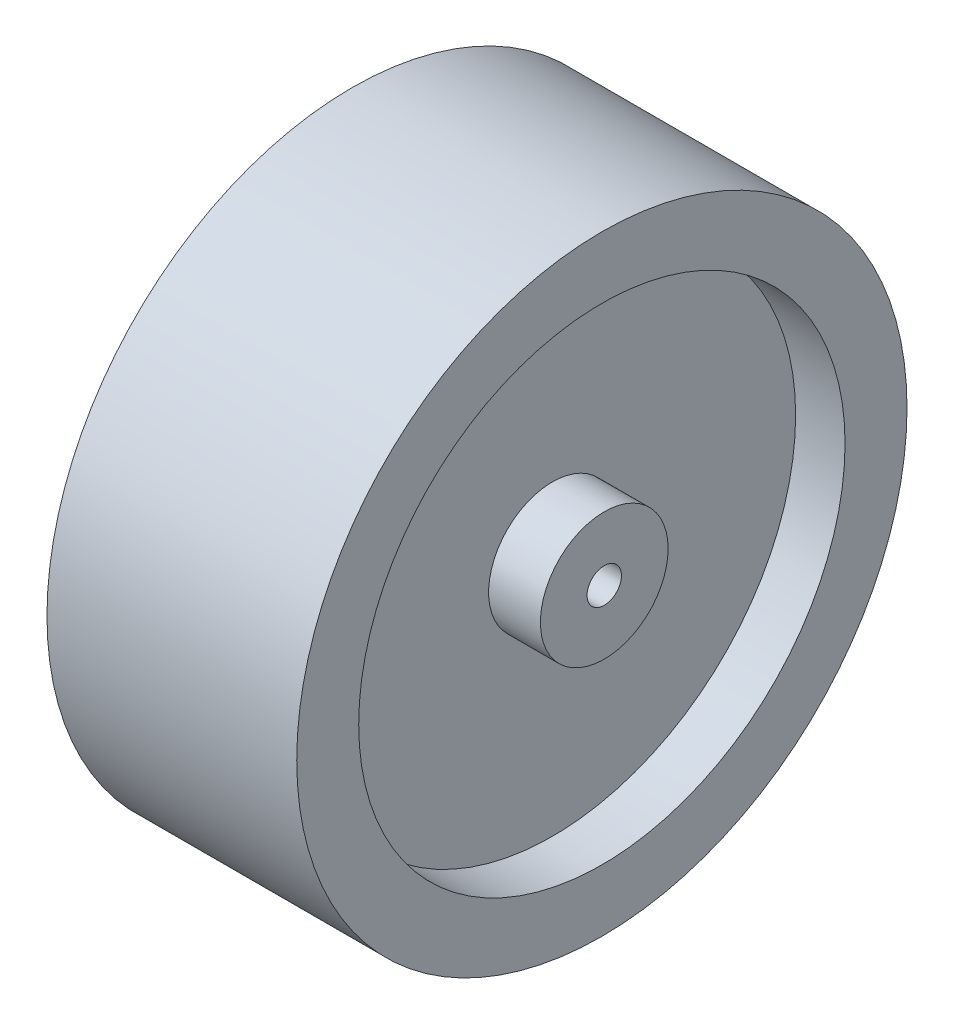
from build123d import *

# Parameters (mm, degrees)
SKETCH2_R               = 32.5
BOSS_EXTRUDE1_DEPTH     = 26.6
SKETCH3_R               = 25.9
CUT_EXTRUDE2_DEPTH      = 5.264
CUT_EXTRUDE3_START      = -13.646
SKETCH4_R               = 25.9
CUT_EXTRUDE3_DEPTH      = 13.646
SKETCH5_R               = 6.8
BOSS_EXTRUDE2_DEPTH     = 13.646
BOSS_EXTRUDE3_START     = 5.518
SKETCH6_R               = 6.8
BOSS_EXTRUDE3_DEPTH     = 5.518
CUT_EXTRUDE4_DEPTH      = 28.702
CUT_EXTRUDE4_DEPTH_BACK = 38.03
SKETCH7_R               = 1.83
SCALE1_SCALE            = 0.8
SCALE2_SCALE            = 0.8
SCALE3_SCALE            = 0.8


with BuildPart() as part:
    # Sketch2 → Boss-Extrude1 (new body)
    with BuildSketch(Plane(origin=(0, 0, 0), x_dir=(0, 0, -1), z_dir=(1, 0, 0))):
        Circle(SKETCH2_R)
    extrude(amount=BOSS_EXTRUDE1_DEPTH)

    # Sketch3 → Cut-Extrude2 (cut)
    with BuildSketch(Plane(origin=(26.6, 0, 0), x_dir=(0, 0, -1), z_dir=(1, 0, 0))):
        Circle(SKETCH3_R)
    extrude(amount=-CUT_EXTRUDE2_DEPTH, mode=Mode.SUBTRACT)

    # Sketch4 → Cut-Extrude3 (cut)
    with BuildSketch(Plane.ZY.offset(CUT_EXTRUDE3_START)):
        with Locations(Location((0, 0, 0), (0, 0, 180))):
            Circle(SKETCH4_R)
    extrude(amount=CUT_EXTRUDE3_DEPTH, mode=Mode.SUBTRACT)

    # Sketch5 → Boss-Extrude2 (add)
    with BuildSketch(Plane.ZY.offset(-13.646)):
        with Locations(Location((0, 0, 0), (0, 0, 180))):
            Circle(SKETCH5_R)
    extrude(amount=BOSS_EXTRUDE2_DEPTH)

    # Sketch6 → Boss-Extrude3 (add)
    with BuildSketch(Plane(origin=(21.336, 0, 0), x_dir=(0, 0, -1), z_dir=(1, 0, 0)).offset(BOSS_EXTRUDE3_START)):
        Circle(SKETCH6_R)
    extrude(amount=-BOSS_EXTRUDE3_DEPTH)

    # Sketch7 → Cut-Extrude4 (cut, two sides: drawn at the far end of the back side and taken through both)
    with BuildSketch(Plane(origin=(26.854, 0, 0), x_dir=(0, 0, -1), z_dir=(1, 0, 0)).offset(-CUT_EXTRUDE4_DEPTH_BACK)):
        with Locations(Location((0, 0, 0), (0, 0, 180))):
            Circle(SKETCH7_R)
    extrude(amount=CUT_EXTRUDE4_DEPTH + CUT_EXTRUDE4_DEPTH_BACK, mode=Mode.SUBTRACT)


with BuildPart() as part_1:
    # Scale1: scaled about (14.550993836, 0, 0)
    add(part.part.scale(SCALE1_SCALE).moved(Location((2.910198767, 0, 0))))


with BuildPart() as part_2:
    # Scale2: scaled about (14.550993836, 0, 0)
    add(part_1.part.scale(SCALE2_SCALE).moved(Location((2.910198767, 0, 0))))


with BuildPart() as part_3:
    # Scale3: scaled about (14.550993836, 0, 0)
    add(part_2.part.scale(SCALE3_SCALE).moved(Location((2.910198767, 0, 0))))


solid = part_3.part
